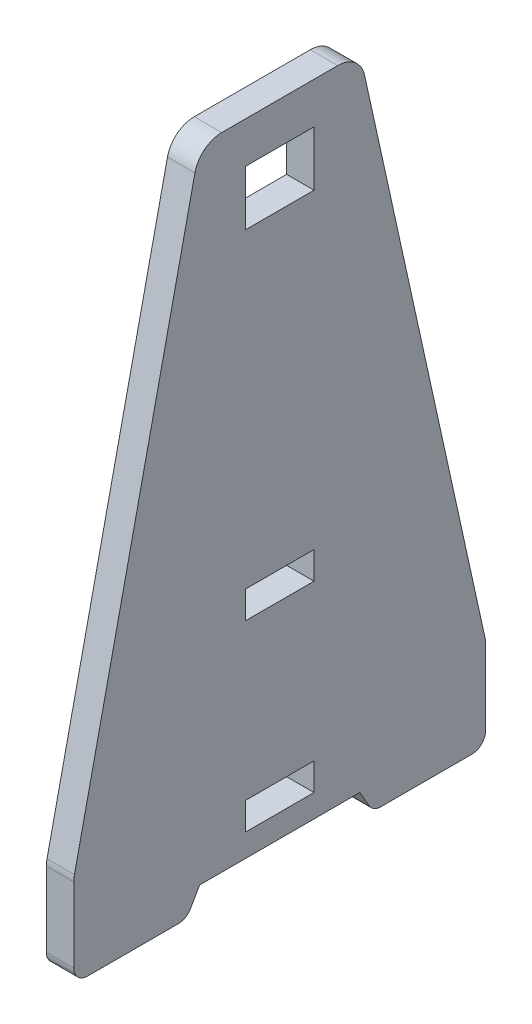
from build123d import *

# Parameters (mm, degrees)
GRUNDPLATTE_DEPTH      = 6
SKIZZE2_W              = 15
SKIZZE2_H              = 12
SKIZZE2_H_2            = 6
ZAPFENDURCHBRUCH_DEPTH = 152.940777937
VERRUNDUNG2_R          = 3
VERRUNDUNG3_R          = 6


with BuildPart() as part:
    # Skizze1 → Grundplatte (new body)
    with BuildSketch(Plane(origin=(0, 0, 0), x_dir=(0, 0, -1), z_dir=(1, 0, 0))):
        Polygon((17.5, 5), (-17.5, 5), (-20.386751346, 0), (-45, 0), (-45, 20), (-17.5, 145), (17.5, 145), (45, 20), (45, 0), (20.386751346, 0), align=None)
    extrude(amount=GRUNDPLATTE_DEPTH)

    # Skizze2 → Zapfendurchbruch (cut, through all)
    with BuildSketch(Plane(origin=(6, 0, 0), x_dir=(0, 0, -1), z_dir=(1, 0, 0))):
        with Locations((0, 130)):
            Rectangle(SKIZZE2_W, SKIZZE2_H)
        with Locations((0, 53)):
            Rectangle(SKIZZE2_W, SKIZZE2_H_2)
        with Locations((0, 13)):
            Rectangle(SKIZZE2_W, SKIZZE2_H_2)
    extrude(amount=-ZAPFENDURCHBRUCH_DEPTH, mode=Mode.SUBTRACT)

    # Verrundung2
    verrundung2_edges = [part.edges().sort_by_distance(p)[0] for p in [
        (3, 0, 20.386751346),
        (3, 0, 45),
        (3, 0, -45),
        (3, 0, -20.386751346),
    ]]
    fillet(verrundung2_edges, radius=VERRUNDUNG2_R)

    # Verrundung3
    verrundung3_edges = [part.edges().sort_by_distance(p)[0] for p in [
        (3, 20, 45),
        (3, 145, 17.5),
        (3, 145, -17.5),
        (3, 20, -45),
    ]]
    fillet(verrundung3_edges, radius=VERRUNDUNG3_R)


solid = part.part
